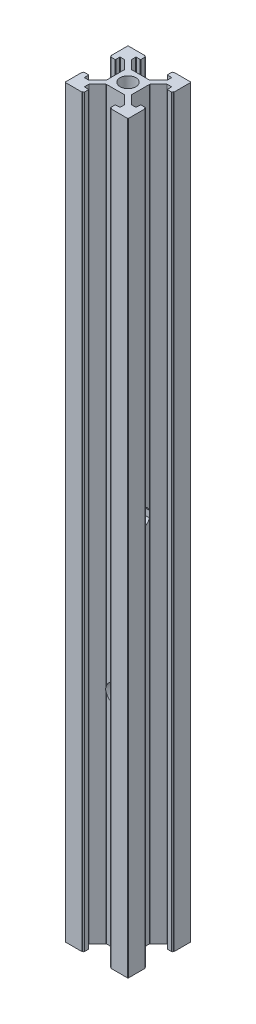
from build123d import *

# Parameters (mm, degrees)
SKETCH1_R               = 2.5
BOSS_EXTRUDE1_DEPTH     = 236
CUT_EXTRUDE1_DEPTH      = 10
CUT_EXTRUDE1_DEPTH_BACK = 10
CUT_EXTRUDE2_DEPTH      = 10
CUT_EXTRUDE2_DEPTH_BACK = 10
SKETCH4_R               = 3


with BuildPart() as part:
    # Sketch1 → Boss-Extrude1 (new body)
    with BuildSketch(Plane(origin=(0, 0, 0), x_dir=(1, 0, 0), z_dir=(0, 1, 0))):
        with BuildLine():
            Line((-10, 4.65), (-9.8, 4.65))
            Line((-9.8, 4.65), (-9.8, 4.4))
            ThreePointArc((-9.8, 4.4), (-9.741421356, 4.258578644), (-9.6, 4.2))
            Line((-9.6, 4.2), (-8.4, 4.2))
            ThreePointArc((-8.4, 4.2), (-8.258578644, 4.258578644), (-8.2, 4.4))
            Line((-8.2, 4.4), (-8.2, 5.45))
            ThreePointArc((-8.2, 5.45), (-8.141421356, 5.591421356), (-8, 5.65))
            Line((-8, 5.65), (-6.832842712, 5.65))
            ThreePointArc((-6.832842712, 5.65), (-6.756306026, 5.634775907), (-6.691421356, 5.591421356))
            Line((-6.691421356, 5.591421356), (-4.058578644, 2.958578644))
            ThreePointArc((-4.058578644, 2.958578644), (-4.015224093, 2.893693974), (-4, 2.817157288))
            Line((-4, 2.817157288), (-4, -2.817157288))
            ThreePointArc((-4, -2.817157288), (-4.015224093, -2.893693974), (-4.058578644, -2.958578644))
            Line((-4.058578644, -2.958578644), (-6.691421356, -5.591421356))
            ThreePointArc((-6.691421356, -5.591421356), (-6.756306026, -5.634775907), (-6.832842712, -5.65))
            Line((-6.832842712, -5.65), (-8, -5.65))
            ThreePointArc((-8, -5.65), (-8.141421356, -5.591421356), (-8.2, -5.45))
            Line((-8.2, -5.45), (-8.2, -4.4))
            ThreePointArc((-8.2, -4.4), (-8.258578644, -4.258578644), (-8.4, -4.2))
            Line((-8.4, -4.2), (-9.6, -4.2))
            ThreePointArc((-9.6, -4.2), (-9.741421356, -4.258578644), (-9.8, -4.4))
            Line((-9.8, -4.4), (-9.8, -4.65))
            Line((-9.8, -4.65), (-10, -4.65))
            Line((-10, -4.65), (-10, -9.8))
            ThreePointArc((-10, -9.8), (-9.941421356, -9.941421356), (-9.8, -10))
            Line((-9.8, -10), (-4.65, -10))
            Line((-4.65, -10), (-4.65, -9.8))
            Line((-4.65, -9.8), (-4.4, -9.8))
            ThreePointArc((-4.4, -9.8), (-4.258578644, -9.741421356), (-4.2, -9.6))
            Line((-4.2, -9.6), (-4.2, -8.4))
            ThreePointArc((-4.2, -8.4), (-4.258578644, -8.258578644), (-4.4, -8.2))
            Line((-4.4, -8.2), (-5.45, -8.2))
            ThreePointArc((-5.45, -8.2), (-5.591421356, -8.141421356), (-5.65, -8))
            Line((-5.65, -8), (-5.65, -6.832842712))
            ThreePointArc((-5.65, -6.832842712), (-5.634775907, -6.756306026), (-5.591421356, -6.691421356))
            Line((-5.591421356, -6.691421356), (-2.958578644, -4.058578644))
            ThreePointArc((-2.958578644, -4.058578644), (-2.893693974, -4.015224093), (-2.817157288, -4))
            Line((-2.817157288, -4), (2.817157288, -4))
            ThreePointArc((2.817157288, -4), (2.893693974, -4.015224093), (2.958578644, -4.058578644))
            Line((2.958578644, -4.058578644), (5.591421356, -6.691421356))
            ThreePointArc((5.591421356, -6.691421356), (5.634775907, -6.756306026), (5.65, -6.832842712))
            Line((5.65, -6.832842712), (5.65, -8))
            ThreePointArc((5.65, -8), (5.591421356, -8.141421356), (5.45, -8.2))
            Line((5.45, -8.2), (4.4, -8.2))
            ThreePointArc((4.4, -8.2), (4.258578644, -8.258578644), (4.2, -8.4))
            Line((4.2, -8.4), (4.2, -9.6))
            ThreePointArc((4.2, -9.6), (4.258578644, -9.741421356), (4.4, -9.8))
            Line((4.4, -9.8), (4.65, -9.8))
            Line((4.65, -9.8), (4.65, -10))
            Line((4.65, -10), (9.8, -10))
            ThreePointArc((9.8, -10), (9.941421356, -9.941421356), (10, -9.8))
            Line((10, -9.8), (10, -4.65))
            Line((10, -4.65), (9.8, -4.65))
            Line((9.8, -4.65), (9.8, -4.4))
            ThreePointArc((9.8, -4.4), (9.741421356, -4.258578644), (9.6, -4.2))
            Line((9.6, -4.2), (8.4, -4.2))
            ThreePointArc((8.4, -4.2), (8.258578644, -4.258578644), (8.2, -4.4))
            Line((8.2, -4.4), (8.2, -5.45))
            ThreePointArc((8.2, -5.45), (8.141421356, -5.591421356), (8, -5.65))
            Line((8, -5.65), (6.832842712, -5.65))
            ThreePointArc((6.832842712, -5.65), (6.756306026, -5.634775907), (6.691421356, -5.591421356))
            Line((6.691421356, -5.591421356), (4.058578644, -2.958578644))
            ThreePointArc((4.058578644, -2.958578644), (4.015224093, -2.893693974), (4, -2.817157288))
            Line((4, -2.817157288), (4, 2.817157288))
            ThreePointArc((4, 2.817157288), (4.015224093, 2.893693974), (4.058578644, 2.958578644))
            Line((4.058578644, 2.958578644), (6.691421356, 5.591421356))
            ThreePointArc((6.691421356, 5.591421356), (6.756306026, 5.634775907), (6.832842712, 5.65))
            Line((6.832842712, 5.65), (8, 5.65))
            ThreePointArc((8, 5.65), (8.141421356, 5.591421356), (8.2, 5.45))
            Line((8.2, 5.45), (8.2, 4.4))
            ThreePointArc((8.2, 4.4), (8.258578644, 4.258578644), (8.4, 4.2))
            Line((8.4, 4.2), (9.6, 4.2))
            ThreePointArc((9.6, 4.2), (9.741421356, 4.258578644), (9.8, 4.4))
            Line((9.8, 4.4), (9.8, 4.65))
            Line((9.8, 4.65), (10, 4.65))
            Line((10, 4.65), (10, 9.8))
            ThreePointArc((10, 9.8), (9.941421356, 9.941421356), (9.8, 10))
            Line((9.8, 10), (4.65, 10))
            Line((4.65, 10), (4.65, 9.8))
            Line((4.65, 9.8), (4.4, 9.8))
            ThreePointArc((4.4, 9.8), (4.258578644, 9.741421356), (4.2, 9.6))
            Line((4.2, 9.6), (4.2, 8.4))
            ThreePointArc((4.2, 8.4), (4.258578644, 8.258578644), (4.4, 8.2))
            Line((4.4, 8.2), (5.45, 8.2))
            ThreePointArc((5.45, 8.2), (5.591421356, 8.141421356), (5.65, 8))
            Line((5.65, 8), (5.65, 6.832842712))
            ThreePointArc((5.65, 6.832842712), (5.634775907, 6.756306026), (5.591421356, 6.691421356))
            Line((5.591421356, 6.691421356), (2.958578644, 4.058578644))
            ThreePointArc((2.958578644, 4.058578644), (2.893693974, 4.015224093), (2.817157288, 4))
            Line((2.817157288, 4), (-2.817157288, 4))
            ThreePointArc((-2.817157288, 4), (-2.893693974, 4.015224093), (-2.958578644, 4.058578644))
            Line((-2.958578644, 4.058578644), (-5.591421356, 6.691421356))
            ThreePointArc((-5.591421356, 6.691421356), (-5.634775907, 6.756306026), (-5.65, 6.832842712))
            Line((-5.65, 6.832842712), (-5.65, 8))
            ThreePointArc((-5.65, 8), (-5.591421356, 8.141421356), (-5.45, 8.2))
            Line((-5.45, 8.2), (-4.4, 8.2))
            ThreePointArc((-4.4, 8.2), (-4.258578644, 8.258578644), (-4.2, 8.4))
            Line((-4.2, 8.4), (-4.2, 9.6))
            ThreePointArc((-4.2, 9.6), (-4.258578644, 9.741421356), (-4.4, 9.8))
            Line((-4.4, 9.8), (-4.65, 9.8))
            Line((-4.65, 9.8), (-4.65, 10))
            Line((-4.65, 10), (-9.8, 10))
            ThreePointArc((-9.8, 10), (-9.941421356, 9.941421356), (-10, 9.8))
            Line((-10, 9.8), (-10, 4.65))
        make_face()
        Circle(SKETCH1_R, mode=Mode.SUBTRACT)
    extrude(amount=BOSS_EXTRUDE1_DEPTH)

    # Sketch2 → Cut-Extrude1 (cut, two sides: drawn at the far end of the back side and taken through both)
    with BuildSketch(Plane(origin=(4, 0, 0), x_dir=(0, 0, -1), z_dir=(1, 0, 0)).offset(-CUT_EXTRUDE1_DEPTH_BACK)):
        with BuildLine():
            ThreePointArc((2.817157288, 119.031321879), (0, 121), (-2.817157288, 119.031321879))
            Line((-2.817157288, 119.031321879), (-2.817157288, 116.968678121))
            ThreePointArc((-2.817157288, 116.968678121), (0, 115), (2.817157288, 116.968678121))
            Line((2.817157288, 116.968678121), (2.817157288, 119.031321879))
        make_face()
    extrude(amount=CUT_EXTRUDE1_DEPTH + CUT_EXTRUDE1_DEPTH_BACK, mode=Mode.SUBTRACT)

    # Sketch4 → Cut-Extrude2 (cut, two sides: drawn at the far end of the back side and taken through both)
    with BuildSketch(Plane.XY.offset(4).offset(-CUT_EXTRUDE2_DEPTH_BACK)):
        with Locations((0, 69.880973817)):
            Circle(SKETCH4_R)
    extrude(amount=CUT_EXTRUDE2_DEPTH + CUT_EXTRUDE2_DEPTH_BACK, mode=Mode.SUBTRACT)


solid = part.part
